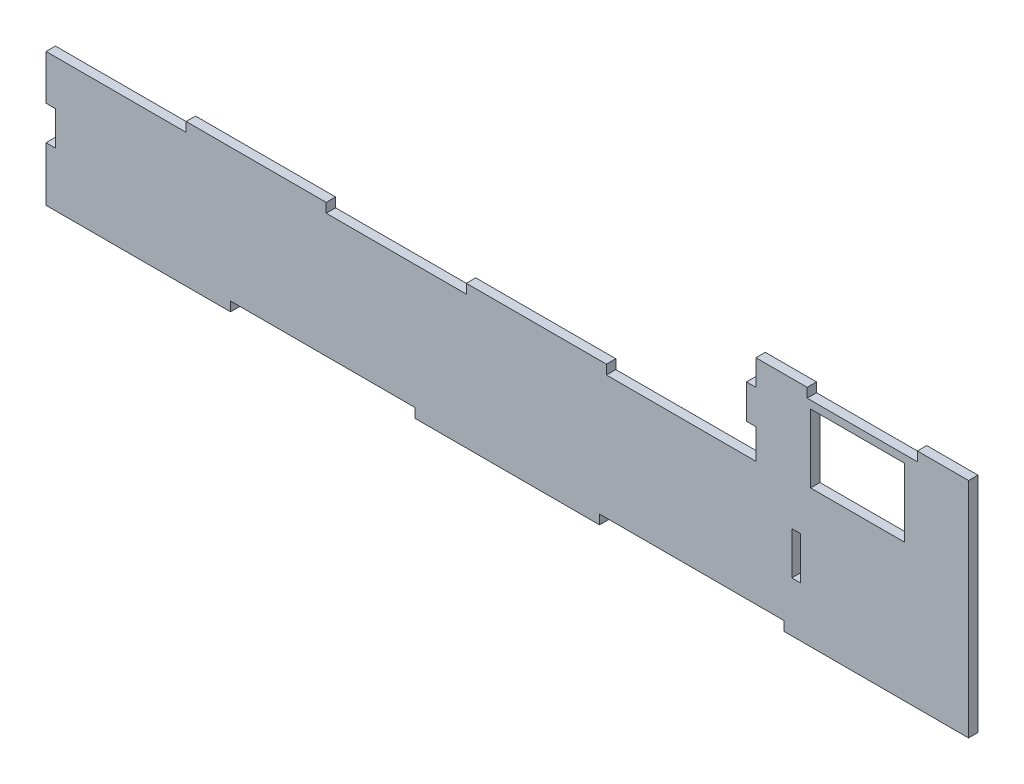
from build123d import *

# Parameters (mm, degrees)
CROQUIS1_W              = 55
CROQUIS1_H              = 40
CROQUIS1_W_2            = 5
CROQUIS1_H_2            = 25
SALIENTE_EXTRUIR1_DEPTH = 5.5


with BuildPart() as part:
    # Croquis1 → Saliente-Extruir1 (new body)
    with BuildSketch(Plane.XY):
        Polygon((-71.983561291, 36.108229285), (-71.983561291, 9.858229285), (-66.483561291, 9.858229285), (-66.483561291, -10.141770715), (-71.983561291, -10.141770715), (-71.983561291, -41.891770715), (36.016438709, -41.891770715), (36.016438709, -36.391770715), (144.016438709, -36.391770715), (144.016438709, -41.891770715), (252.016438709, -41.891770715), (252.016438709, -36.391770715), (360.016438709, -36.391770715), (360.016438709, -41.891770715), (468.016438709, -41.891770715), (468.016438709, 88.608229285), (438.016438709, 88.608229285), (438.016438709, 83.108229285), (373.516438709, 83.108229285), (373.516438709, 88.608229285), (343.516438709, 88.608229285), (343.516438709, 73.608229285), (338.016438709, 73.608229285), (338.016438709, 53.608229285), (343.516438709, 53.608229285), (343.516438709, 36.108229285), (338.016438709, 36.108229285), (256.016438709, 36.108229285), (256.016438709, 41.608229285), (174.016438709, 41.608229285), (174.016438709, 36.108229285), (92.016438709, 36.108229285), (92.016438709, 41.608229285), (10.016438709, 41.608229285), (10.016438709, 36.108229285), align=None)
        with Locations((403.016438709, 58.608229285)):
            Rectangle(CROQUIS1_W, CROQUIS1_H, mode=Mode.SUBTRACT)
        with Locations((367.016438709, 0)):
            Rectangle(CROQUIS1_W_2, CROQUIS1_H_2, mode=Mode.SUBTRACT)
    extrude(amount=SALIENTE_EXTRUIR1_DEPTH)


solid = part.part
